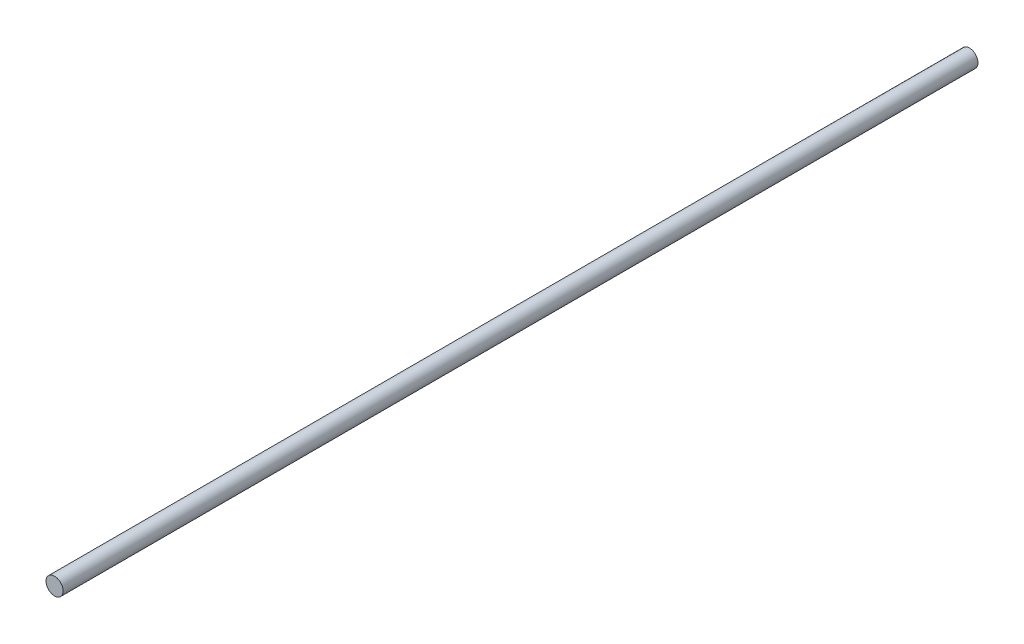
from build123d import *

# Parameters (mm, degrees)
SKETCH1_R           = 1.5
BOSS_EXTRUDE1_DEPTH = 160


with BuildPart() as part:
    # Sketch1 → Boss-Extrude1 (new body)
    with BuildSketch(Plane.XY):
        Circle(SKETCH1_R)
    extrude(amount=BOSS_EXTRUDE1_DEPTH)


solid = part.part
